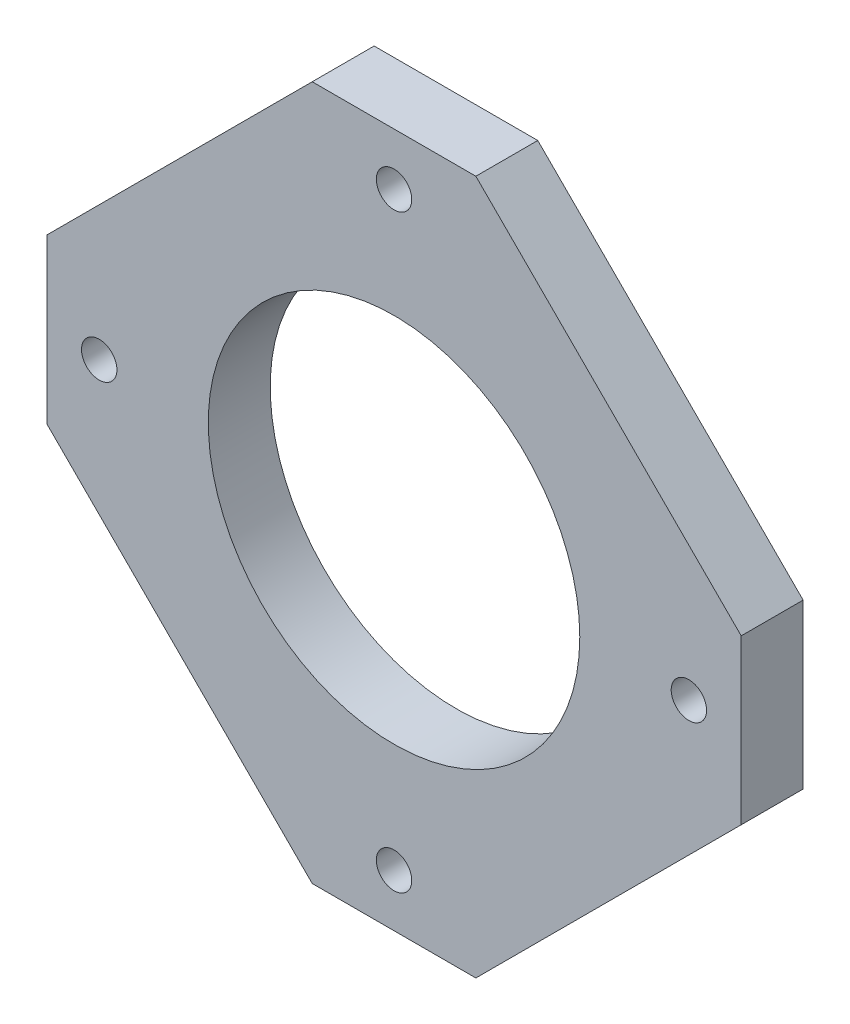
from build123d import *

# Parameters (mm, degrees)
SKETCH1_W           = 78.5
SKETCH1_H           = 78.5
BOSS_EXTRUDE1_DEPTH = 3.5
SKETCH3_R           = 21
CUT_EXTRUDE2_DEPTH  = 56.947520052
SKETCH4_R           = 2
CUT_EXTRUDE3_DEPTH  = 56.947520052
CHAMFER1_SIZE       = 30


with BuildPart() as part:
    # Sketch1 → Boss-Extrude1 (new, symmetric)
    with BuildSketch(Plane.XY):
        Rectangle(SKETCH1_W, SKETCH1_H)
    extrude(amount=BOSS_EXTRUDE1_DEPTH, both=True)

    # Sketch3 → Cut-Extrude2 (cut, through all)
    with BuildSketch(Plane.XY.offset(3.5)):
        Circle(SKETCH3_R)
    extrude(amount=-CUT_EXTRUDE2_DEPTH, mode=Mode.SUBTRACT)

    # Sketch4 → Cut-Extrude3 (cut, through all)
    with BuildSketch(Plane.XY.offset(3.5)):
        with Locations((0, 33.333013665)):
            Circle(SKETCH4_R)
        with Locations((-33.333013665, 0)):
            Circle(SKETCH4_R)
        with Locations((0, -33.333013665)):
            Circle(SKETCH4_R)
        with Locations((33.333013665, 0)):
            Circle(SKETCH4_R)
    extrude(amount=-CUT_EXTRUDE3_DEPTH, mode=Mode.SUBTRACT)

    # Chamfer1
    chamfer1_edges = [part.edges().sort_by_distance(p)[0] for p in [
        (39.25, -39.25, 0),
        (-39.25, -39.25, 0),
        (-39.25, 39.25, 0),
        (39.25, 39.25, 0),
    ]]
    chamfer(chamfer1_edges, length=CHAMFER1_SIZE)


solid = part.part
